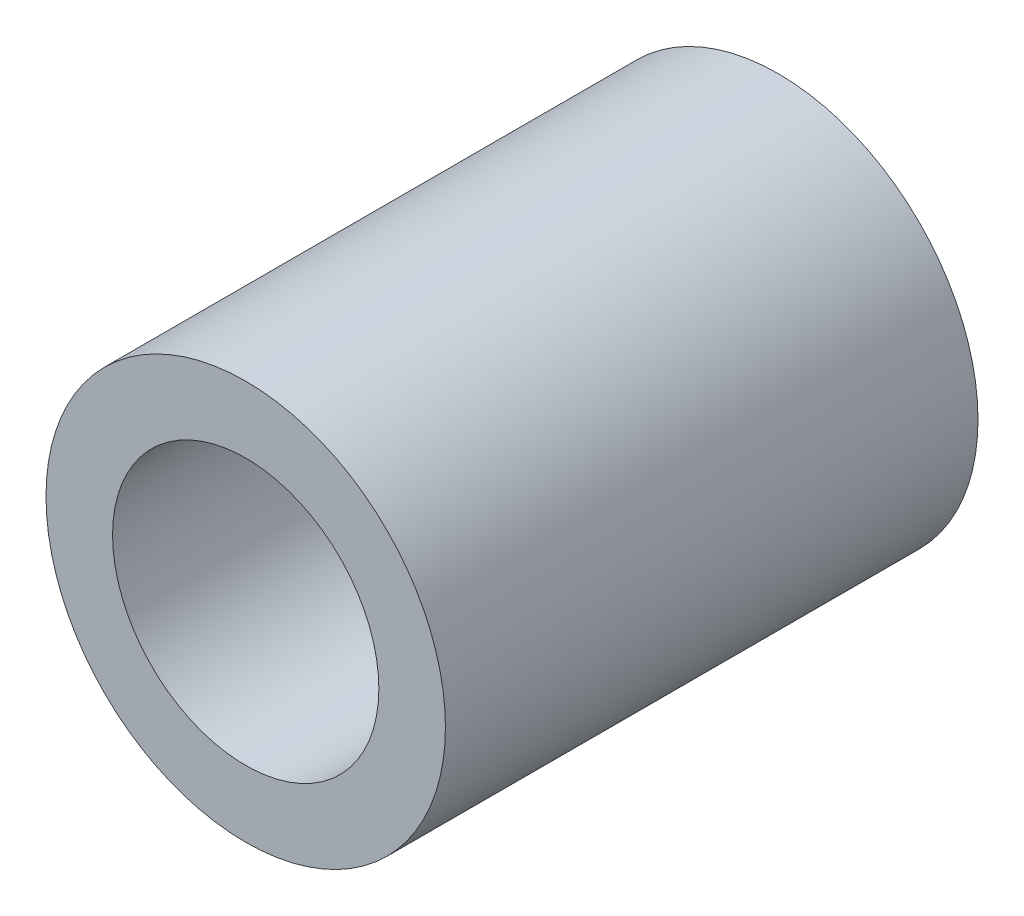
from build123d import *

# Parameters (mm, degrees)
SKETCH1_R      = 9.525
SKETCH1_R_2    = 6.35
EXTRUDE1_DEPTH = 12.7


with BuildPart() as part:
    # Sketch1 → Extrude1 (new, symmetric)
    with BuildSketch(Plane.XY):
        Circle(SKETCH1_R)
        Circle(SKETCH1_R_2, mode=Mode.SUBTRACT)
    extrude(amount=EXTRUDE1_DEPTH, both=True)


solid = part.part
